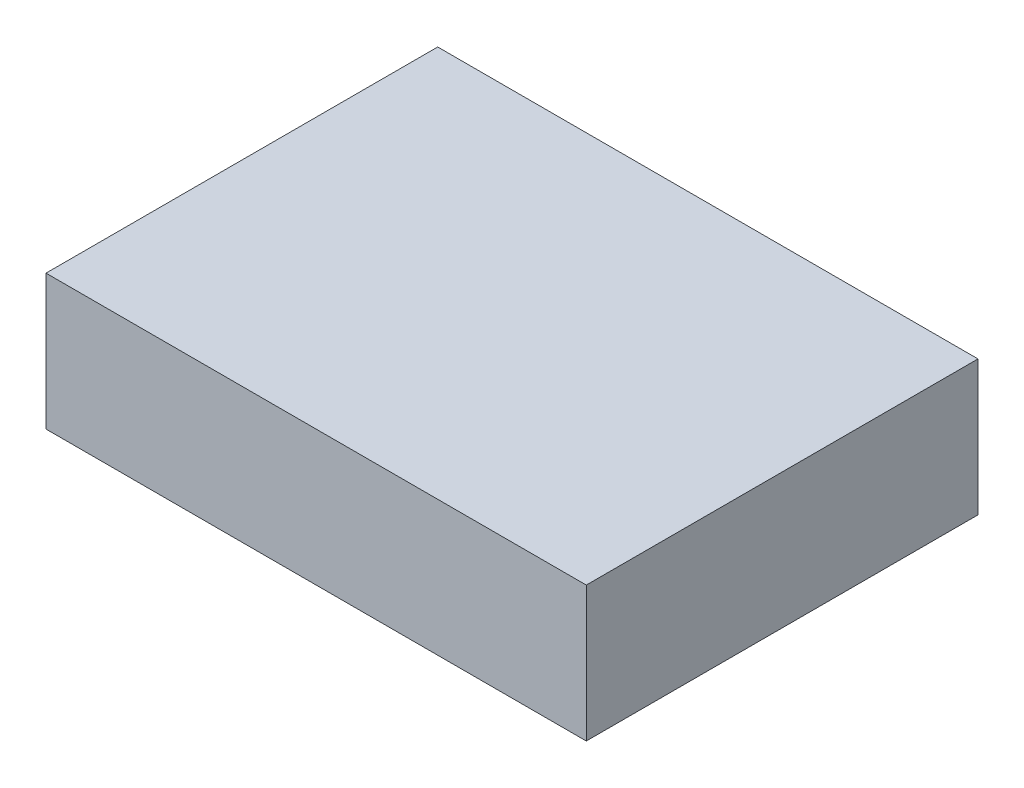
from build123d import *

# Parameters (mm, degrees)
SKETCH1_W           = 40
SKETCH1_H           = 29
BOSS_EXTRUDE1_DEPTH = 10


with BuildPart() as part:
    # Sketch1 → Boss-Extrude1 (new body)
    with BuildSketch(Plane(origin=(0, 0, 0), x_dir=(1, 0, 0), z_dir=(0, 1, 0))):
        with Locations((20, 14.5)):
            Rectangle(SKETCH1_W, SKETCH1_H)
    extrude(amount=BOSS_EXTRUDE1_DEPTH)


solid = part.part
